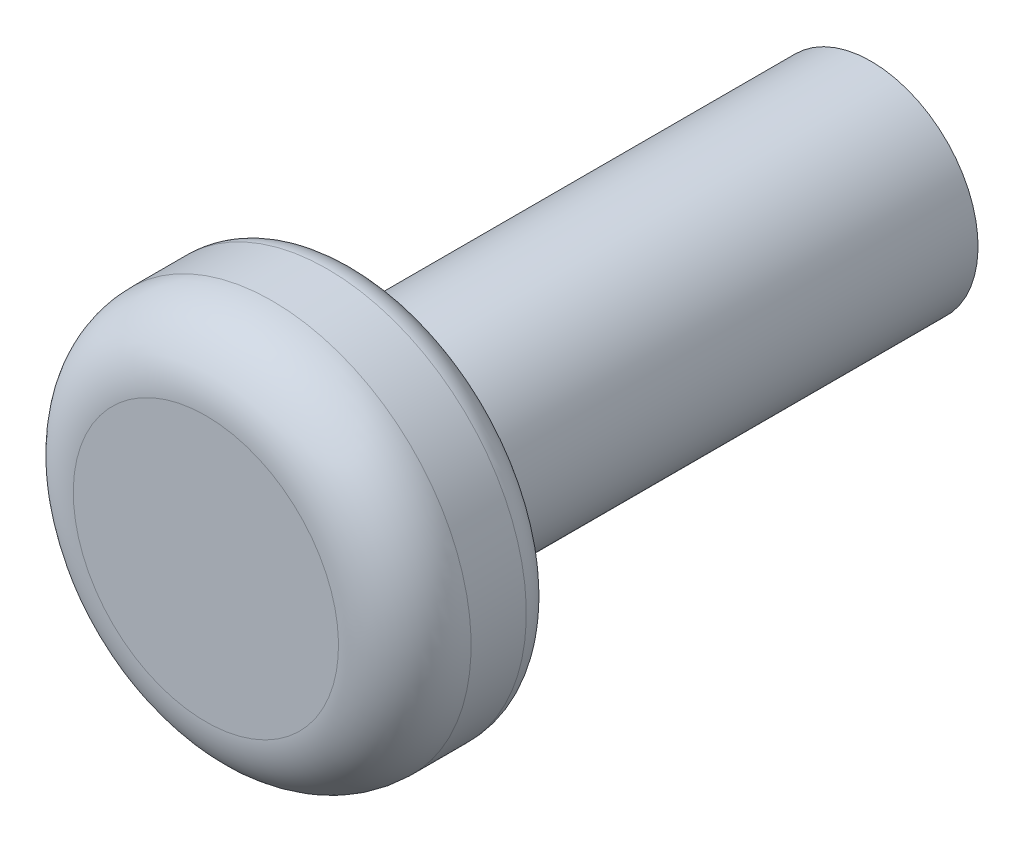
from build123d import *

# Parameters (mm, degrees)
SKETCH1_R      = 4.65
EXTRUDE3_DEPTH = 3.55
SKETCH17_W     = 12
SKETCH17_H     = 2.5


with BuildPart() as part:
    # Sketch1 → Extrude3 (new body)
    with BuildSketch(Plane.XY):
        Circle(SKETCH1_R)
    extrude(amount=EXTRUDE3_DEPTH)

    # Sketch11 → Cut-Revolve3 (revolve, cut)
    with BuildSketch(Plane(origin=(0, 0, 0), x_dir=(0, 0, -1), z_dir=(1, 0, 0))):
        with BuildLine():
            Line((-2, 4.65), (-0.71, 4.65))
            ThreePointArc((-0.71, 4.65), (-0.207954185, 4.442045815), (0, 3.94))
            Line((0, 3.94), (0.254, 3.94))
            Line((0.254, 3.94), (0.254, 4.904))
            Line((0.254, 4.904), (-3.804, 4.904))
            Line((-3.804, 4.904), (-3.804, 3.1))
            Line((-3.804, 3.1), (-3.55, 3.1))
            ThreePointArc((-3.55, 3.1), (-3.096015511, 4.196015511), (-2, 4.65))
        make_face()
    revolve(axis=Axis((0, 0, 0), (0, 0, 1)), mode=Mode.SUBTRACT)


with BuildPart() as body_2:
    # Sketch17 → Revolve1 (revolve)
    with BuildSketch(Plane(origin=(0, 0, 0), x_dir=(0, 0, -1), z_dir=(1, 0, 0))):
        with Locations((6, 1.25)):
            Rectangle(SKETCH17_W, SKETCH17_H)
    revolve(axis=Axis((0, 0, 0), (0, 0, 1)))


solid = Compound([part.part, body_2.part])
